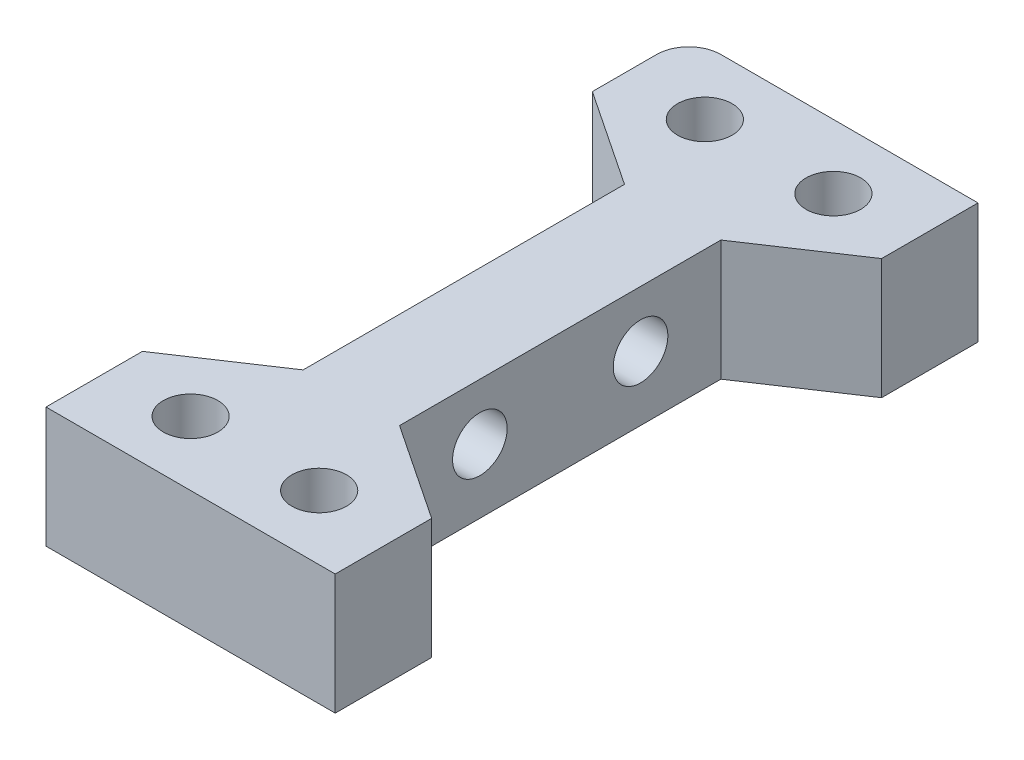
from build123d import *

# Parameters (mm, degrees)
SKETCH1_R           = 1.7
SKETCH1_W           = 6
SKETCH1_H           = 20
BOSS_EXTRUDE1_DEPTH = 7.5
SKETCH3_R           = 1.7
CUT_EXTRUDE2_DEPTH  = 6
FILLET1_R           = 2


with BuildPart() as part:
    # Sketch1 → Boss-Extrude1 (new body)
    # profile 1 of 3: a face of its own
    with BuildSketch(Plane(origin=(0, 0, 0), x_dir=(1, 0, 0), z_dir=(0, 1, 0))):
        Polygon((-3, -10), (3, -10), (9, -14), (9, -20), (-9, -20), (-9, -14), align=None)
        with Locations(Location((4, -16, 0), (0, 0, 270))):
            Circle(SKETCH1_R, mode=Mode.SUBTRACT)
        with Locations(Location((-4, -16, 0), (0, 0, 270))):
            Circle(SKETCH1_R, mode=Mode.SUBTRACT)
    # profile 2 of 3: a face of its own
    with BuildSketch(Plane(origin=(0, 0, 0), x_dir=(1, 0, 0), z_dir=(0, 1, 0))):
        Rectangle(SKETCH1_W, SKETCH1_H)
    # profile 3 of 3: a face of its own
    with BuildSketch(Plane(origin=(0, 0, 0), x_dir=(1, 0, 0), z_dir=(0, 1, 0))):
        Polygon((9, 14), (3, 10), (-3, 10), (-9, 14), (-9, 20), (9, 20), align=None)
        with Locations(Location((4, 16, 0), (0, 0, 270))):
            Circle(SKETCH1_R, mode=Mode.SUBTRACT)
        with Locations(Location((-4, 16, 0), (0, 0, 270))):
            Circle(SKETCH1_R, mode=Mode.SUBTRACT)
    extrude(amount=BOSS_EXTRUDE1_DEPTH)

    # Sketch3 → Cut-Extrude2 (cut)
    with BuildSketch(Plane(origin=(3, 0, 0), x_dir=(0, 0, -1), z_dir=(1, 0, 0))):
        with Locations((-5, 4)):
            Circle(SKETCH3_R)
        with Locations((5, 4)):
            Circle(SKETCH3_R)
    extrude(amount=-CUT_EXTRUDE2_DEPTH, mode=Mode.SUBTRACT)

    # Fillet1
    fillet1_edges = [part.edges().sort_by_distance(p)[0] for p in [
        (-9, 3.75, -20),
    ]]
    fillet(fillet1_edges, radius=FILLET1_R)


solid = part.part
